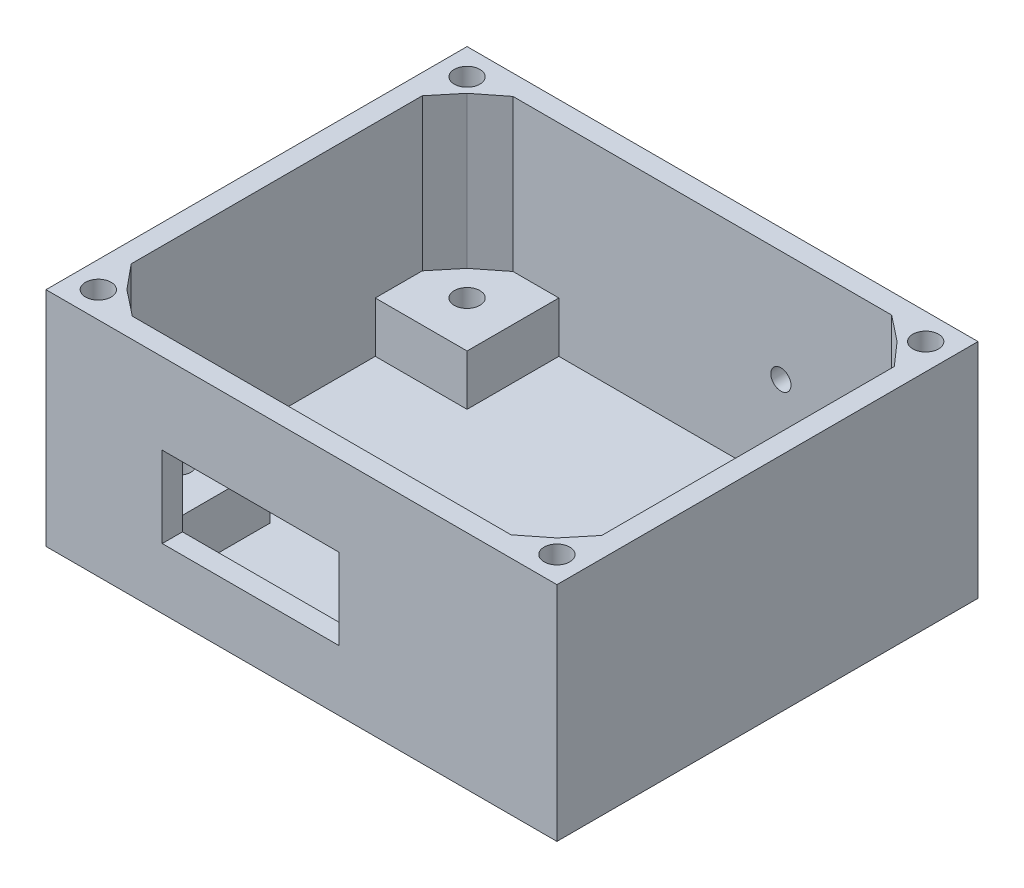
from build123d import *

# Parameters (mm, degrees)
SKETCH2_W            = 2
SKETCH2_H            = 2
BOSS_EXTRUDE3_DEPTH  = 20
SKETCH3_W            = 9.08
SKETCH3_H            = 9.08
CUT_EXTRUDE1_DEPTH   = 15
SKETCH4_W            = 9.08
SKETCH4_H            = 9.08
CUT_EXTRUDE2_DEPTH   = 15
SKETCH5_W            = 9.08
SKETCH5_H            = 9.08
CUT_EXTRUDE3_DEPTH   = 15
SKETCH6_W            = 9.08
SKETCH6_H            = 9.08
CUT_EXTRUDE4_DEPTH   = 15
SKETCH7_W            = 50.545
SKETCH7_H            = 41.655
BOSS_EXTRUDE4_DEPTH  = 2
SKETCH9_W            = 17.5
SKETCH9_H            = 4
CUT_EXTRUDE8_DEPTH   = 10
BOSS_EXTRUDE5_DEPTH  = 15
SKETCH11_R           = 1.27
CUT_EXTRUDE9_DEPTH   = 8
BOSS_EXTRUDE9_DEPTH  = 18
CUT_EXTRUDE12_DEPTH  = 8
BOSS_EXTRUDE10_DEPTH = 18
CUT_EXTRUDE13_DEPTH  = 8
BOSS_EXTRUDE11_DEPTH = 18
CUT_EXTRUDE14_DEPTH  = 8
SKETCH22_R           = 1
CUT_EXTRUDE16_DEPTH  = 8


with BuildPart() as part:
    # Sketch2 → Boss-Extrude3 (new body)
    with BuildSketch(Plane(origin=(0, 0, 0), x_dir=(1, 0, 0), z_dir=(0, 1, 0))):
        Polygon((42.005, 24.035), (42.005, 33.115), (44.005, 33.115), (44.005, -4.54), (42.005, -4.54), (42.005, 4.54), align=None)
        with Locations((43.005, -5.54)):
            Rectangle(SKETCH2_W, SKETCH2_H)
        Polygon((4.54, -4.54), (32.925, -4.54), (37.465, -4.54), (42.005, -4.54), (42.005, -6.54), (-4.54, -6.54), (-4.54, -4.54), align=None)
        with Locations((-5.54, -5.54)):
            Rectangle(SKETCH2_W, SKETCH2_H)
        Polygon((-4.54, 24.035), (-4.54, 4.54), (-4.54, -4.54), (-6.54, -4.54), (-6.54, 33.115), (-4.54, 33.115), align=None)
        with Locations((-5.54, 34.115)):
            Rectangle(SKETCH2_W, SKETCH2_H)
        Polygon((4.54, 33.115), (-4.54, 33.115), (-4.54, 35.115), (42.005, 35.115), (42.005, 33.115), (32.925, 33.115), align=None)
        with Locations((43.005, 34.115)):
            Rectangle(SKETCH2_W, SKETCH2_H)
        with BuildLine():
            Line((37.465, 27.305), (37.465, 24.035))
            Line((37.465, 24.035), (42.005, 24.035))
            Line((42.005, 24.035), (42.005, 33.115))
            Line((42.005, 33.115), (32.925, 33.115))
            Line((32.925, 33.115), (32.925, 28.575))
            Line((32.925, 28.575), (36.195, 28.575))
            ThreePointArc((36.195, 28.575), (37.465, 29.845), (38.735, 28.575))
            ThreePointArc((38.735, 28.575), (38.363025612, 27.676974388), (37.465, 27.305))
        make_face()
        with BuildLine():
            Line((32.925, 24.035), (37.465, 24.035))
            Line((37.465, 24.035), (37.465, 27.305))
            ThreePointArc((37.465, 27.305), (36.566974388, 27.676974388), (36.195, 28.575))
            Line((36.195, 28.575), (32.925, 28.575))
            Line((32.925, 28.575), (32.925, 24.035))
        make_face()
        with BuildLine():
            Line((37.465, 4.54), (37.465, 1.27))
            ThreePointArc((37.465, 1.27), (38.363025612, 0.898025612), (38.735, 0))
            ThreePointArc((38.735, 0), (38.363025612, -0.898025612), (37.465, -1.27))
            Line((37.465, -1.27), (37.465, -4.54))
            Line((37.465, -4.54), (42.005, -4.54))
            Line((42.005, -4.54), (42.005, 4.54))
            Line((42.005, 4.54), (37.465, 4.54))
        make_face()
        with BuildLine():
            Line((32.925, 4.54), (32.925, 0))
            Line((32.925, 0), (36.195, 0))
            ThreePointArc((36.195, 0), (36.566974388, 0.898025612), (37.465, 1.27))
            Line((37.465, 1.27), (37.465, 4.54))
            Line((37.465, 4.54), (32.925, 4.54))
        make_face()
        with BuildLine():
            Line((36.195, 0), (32.925, 0))
            Line((32.925, 0), (32.925, -4.54))
            Line((32.925, -4.54), (37.465, -4.54))
            Line((37.465, -4.54), (37.465, -1.27))
            ThreePointArc((37.465, -1.27), (36.566974388, -0.898025612), (36.195, 0))
        make_face()
        with BuildLine():
            Line((0, 27.305), (0, 24.035))
            Line((0, 24.035), (4.54, 24.035))
            Line((4.54, 24.035), (4.54, 28.575))
            Line((4.54, 28.575), (1.27, 28.575))
            ThreePointArc((1.27, 28.575), (0.898025612, 27.676974388), (0, 27.305))
        make_face()
        with BuildLine():
            Line((-4.54, 24.035), (0, 24.035))
            Line((0, 24.035), (0, 27.305))
            ThreePointArc((0, 27.305), (-0.898025612, 29.473025612), (1.27, 28.575))
            Line((1.27, 28.575), (4.54, 28.575))
            Line((4.54, 28.575), (4.54, 33.115))
            Line((4.54, 33.115), (-4.54, 33.115))
            Line((-4.54, 33.115), (-4.54, 24.035))
        make_face()
        with BuildLine():
            ThreePointArc((0, 1.27), (0.898025612, 0.898025612), (1.27, 0))
            Line((1.27, 0), (4.54, 0))
            Line((4.54, 0), (4.54, 4.54))
            Line((4.54, 4.54), (0, 4.54))
            Line((0, 4.54), (0, 1.27))
        make_face()
        with BuildLine():
            Line((4.54, 0), (1.27, 0))
            ThreePointArc((1.27, 0), (-0.898025612, -0.898025612), (0, 1.27))
            Line((0, 1.27), (0, 4.54))
            Line((0, 4.54), (-4.54, 4.54))
            Line((-4.54, 4.54), (-4.54, -4.54))
            Line((-4.54, -4.54), (4.54, -4.54))
            Line((4.54, -4.54), (4.54, 0))
        make_face()
    extrude(amount=BOSS_EXTRUDE3_DEPTH)

    # Sketch3 → Cut-Extrude1 (cut)
    with BuildSketch(Plane(origin=(0, 20, 0), x_dir=(1, 0, 0), z_dir=(0, 1, 0))):
        with Locations((37.465, 28.575)):
            Rectangle(SKETCH3_W, SKETCH3_H)
    extrude(amount=-CUT_EXTRUDE1_DEPTH, mode=Mode.SUBTRACT)

    # Sketch4 → Cut-Extrude2 (cut)
    with BuildSketch(Plane(origin=(0, 20, 0), x_dir=(1, 0, 0), z_dir=(0, 1, 0))):
        with Locations((0, 28.575)):
            Rectangle(SKETCH4_W, SKETCH4_H)
    extrude(amount=-CUT_EXTRUDE2_DEPTH, mode=Mode.SUBTRACT)

    # Sketch5 → Cut-Extrude3 (cut)
    with BuildSketch(Plane(origin=(0, 20, 0), x_dir=(1, 0, 0), z_dir=(0, 1, 0))):
        with Locations((37.465, 0)):
            Rectangle(SKETCH5_W, SKETCH5_H)
    extrude(amount=-CUT_EXTRUDE3_DEPTH, mode=Mode.SUBTRACT)

    # Sketch6 → Cut-Extrude4 (cut)
    with BuildSketch(Plane(origin=(0, 20, 0), x_dir=(1, 0, 0), z_dir=(0, 1, 0))):
        Rectangle(SKETCH6_W, SKETCH6_H)
    extrude(amount=-CUT_EXTRUDE4_DEPTH, mode=Mode.SUBTRACT)

    # Sketch7 → Boss-Extrude4 (add)
    with BuildSketch(Plane.XZ):
        with Locations((18.7325, -14.2875)):
            Rectangle(SKETCH7_W, SKETCH7_H)
    extrude(amount=BOSS_EXTRUDE4_DEPTH)

    # Sketch9 → Cut-Extrude8 (cut)
    with BuildSketch(Plane.XY.offset(6.54)):
        with Locations((13.71, 10)):
            Rectangle(SKETCH9_W, SKETCH9_H)
        with Locations((13.71, 6)):
            Rectangle(SKETCH9_W, SKETCH9_H)
    extrude(amount=-CUT_EXTRUDE8_DEPTH, mode=Mode.SUBTRACT)

    # Sketch10 → Boss-Extrude5 (add)
    with BuildSketch(Plane(origin=(0, 5, 0), x_dir=(1, 0, 0), z_dir=(0, 1, 0))):
        Polygon((42.005, -0.108012912), (40.005, -2.54), (42.005, -2.54), align=None)
        Polygon((42.005, -2.54), (40.005, -2.54), (37.465, -4.54), (42.005, -4.54), align=None)
    extrude(amount=BOSS_EXTRUDE5_DEPTH)

    # Sketch11 → Cut-Extrude9 (cut)
    with BuildSketch(Plane(origin=(0, 20, 0), x_dir=(1, 0, 0), z_dir=(0, 1, 0))):
        with Locations(Location((41.419213562, -3.954213562, 0), (0, 0, 270))):
            Circle(SKETCH11_R)
    extrude(amount=-CUT_EXTRUDE9_DEPTH, mode=Mode.SUBTRACT)

    # Sketch12 → Boss-Extrude9 (add)
    with BuildSketch(Plane(origin=(0, 20, 0), x_dir=(1, 0, 0), z_dir=(0, 1, 0))):
        with BuildLine():
            Line((37.465, 33.115), (40.002775618, 31.112775618))
            Line((40.002775618, 31.112775618), (40.516974388, 31.626974388))
            ThreePointArc((40.516974388, 31.626974388), (40.15947529, 32.333799314), (40.290366726, 33.115))
            Line((40.290366726, 33.115), (37.465, 33.115))
        make_face()
        with BuildLine():
            Line((40.002775618, 31.112775618), (42.005, 28.835))
            Line((42.005, 28.835), (42.005, 31.400366726))
            ThreePointArc((42.005, 31.400366726), (41.223799314, 31.26947529), (40.516974388, 31.626974388))
            Line((40.516974388, 31.626974388), (40.002775618, 31.112775618))
        make_face()
        Polygon((41.415, 32.525), (42.005, 32.525), (42.005, 33.115), align=None)
        Polygon((41.415, 33.115), (41.415, 32.525), (42.005, 33.115), align=None)
        with BuildLine():
            ThreePointArc((40.516974388, 31.626974388), (41.223799314, 31.26947529), (42.005, 31.400366726))
            Line((42.005, 31.400366726), (42.005, 32.525))
            Line((42.005, 32.525), (41.415, 32.525))
            Line((41.415, 32.525), (40.516974388, 31.626974388))
        make_face()
        with BuildLine():
            Line((42.005, 32.525), (42.685, 32.525))
            ThreePointArc((42.685, 32.525), (42.588327006, 33.011007959), (42.313025612, 33.423025612))
            Line((42.313025612, 33.423025612), (42.005, 33.115))
            Line((42.005, 33.115), (42.005, 32.525))
        make_face()
        with BuildLine():
            ThreePointArc((40.290366726, 33.115), (40.15947529, 32.333799314), (40.516974388, 31.626974388))
            Line((40.516974388, 31.626974388), (41.415, 32.525))
            Line((41.415, 32.525), (41.415, 33.115))
            Line((41.415, 33.115), (40.290366726, 33.115))
        make_face()
        with BuildLine():
            Line((42.005, 33.115), (42.313025612, 33.423025612))
            ThreePointArc((42.313025612, 33.423025612), (41.901007959, 33.698327006), (41.415, 33.795))
            Line((41.415, 33.795), (41.415, 33.115))
            Line((41.415, 33.115), (42.005, 33.115))
        make_face()
    extrude(amount=-BOSS_EXTRUDE9_DEPTH)

    # Sketch17 → Cut-Extrude12 (cut)
    with BuildSketch(Plane(origin=(0, 20, 0), x_dir=(1, 0, 0), z_dir=(0, 1, 0))):
        with BuildLine():
            ThreePointArc((42.686989181, 32.526989181), (42.590316187, 33.01299714), (42.315014793, 33.425014793))
            Line((42.315014793, 33.425014793), (41.416989181, 32.526989181))
            Line((41.416989181, 32.526989181), (40.518963569, 31.628963569))
            ThreePointArc((40.518963569, 31.628963569), (41.90299714, 31.353662175), (42.686989181, 32.526989181))
        make_face()
        with BuildLine():
            Line((41.416989181, 32.526989181), (42.315014793, 33.425014793))
            ThreePointArc((42.315014793, 33.425014793), (40.518963569, 33.425014793), (40.518963569, 31.628963569))
            Line((40.518963569, 31.628963569), (41.416989181, 32.526989181))
        make_face()
    extrude(amount=-CUT_EXTRUDE12_DEPTH, mode=Mode.SUBTRACT)

    # Sketch18 → Boss-Extrude10 (add)
    with BuildSketch(Plane(origin=(0, 20, 0), x_dir=(1, 0, 0), z_dir=(0, 1, 0))):
        Polygon((-4.54, -0.11), (-4.54, -4.54), (-2.537775618, -2.537775618), align=None)
        Polygon((-2.537775618, -2.537775618), (-4.54, -4.54), (0, -4.54), align=None)
    extrude(amount=-BOSS_EXTRUDE10_DEPTH)

    # Sketch19 → Cut-Extrude13 (cut)
    with BuildSketch(Plane(origin=(0, 20, 0), x_dir=(1, 0, 0), z_dir=(0, 1, 0))):
        with BuildLine():
            ThreePointArc((-3.053963569, -3.053963569), (-4.850014793, -3.053963569), (-4.850014793, -4.850014793))
            Line((-4.850014793, -4.850014793), (-3.951989181, -3.951989181))
            Line((-3.951989181, -3.951989181), (-3.053963569, -3.053963569))
        make_face()
        with BuildLine():
            Line((-3.951989181, -3.951989181), (-4.850014793, -4.850014793))
            ThreePointArc((-4.850014793, -4.850014793), (-3.465981222, -5.125316187), (-2.681989181, -3.951989181))
            ThreePointArc((-2.681989181, -3.951989181), (-2.778662175, -3.465981222), (-3.053963569, -3.053963569))
            Line((-3.053963569, -3.053963569), (-3.951989181, -3.951989181))
        make_face()
    extrude(amount=-CUT_EXTRUDE13_DEPTH, mode=Mode.SUBTRACT)

    # Sketch20 → Boss-Extrude11 (add)
    with BuildSketch(Plane(origin=(0, 20, 0), x_dir=(1, 0, 0), z_dir=(0, 1, 0))):
        Polygon((0, 33.115), (-4.54, 33.115), (-2.537775618, 31.112775618), align=None)
        Polygon((-2.537775618, 31.112775618), (-4.54, 33.115), (-4.54, 28.685), align=None)
    extrude(amount=-BOSS_EXTRUDE11_DEPTH)

    # Sketch21 → Cut-Extrude14 (cut)
    with BuildSketch(Plane(origin=(0, 20, 0), x_dir=(1, 0, 0), z_dir=(0, 1, 0))):
        with BuildLine():
            ThreePointArc((-2.681989181, 32.526989181), (-3.465981222, 33.700316187), (-4.850014793, 33.425014793))
            Line((-4.850014793, 33.425014793), (-3.951989181, 32.526989181))
            Line((-3.951989181, 32.526989181), (-3.053963569, 31.628963569))
            ThreePointArc((-3.053963569, 31.628963569), (-2.778662175, 32.040981222), (-2.681989181, 32.526989181))
        make_face()
        with BuildLine():
            Line((-3.951989181, 32.526989181), (-4.850014793, 33.425014793))
            ThreePointArc((-4.850014793, 33.425014793), (-4.850014793, 31.628963569), (-3.053963569, 31.628963569))
            Line((-3.053963569, 31.628963569), (-3.951989181, 32.526989181))
        make_face()
    extrude(amount=-CUT_EXTRUDE14_DEPTH, mode=Mode.SUBTRACT)

    # Sketch22 → Cut-Extrude16 (cut)
    with BuildSketch(Plane(origin=(0, 0, -35.115), x_dir=(-1, 0, 0), z_dir=(0, 0, -1))):
        with Locations((-26.505, 9)):
            Circle(SKETCH22_R)
    extrude(amount=-CUT_EXTRUDE16_DEPTH, mode=Mode.SUBTRACT)


solid = part.part
